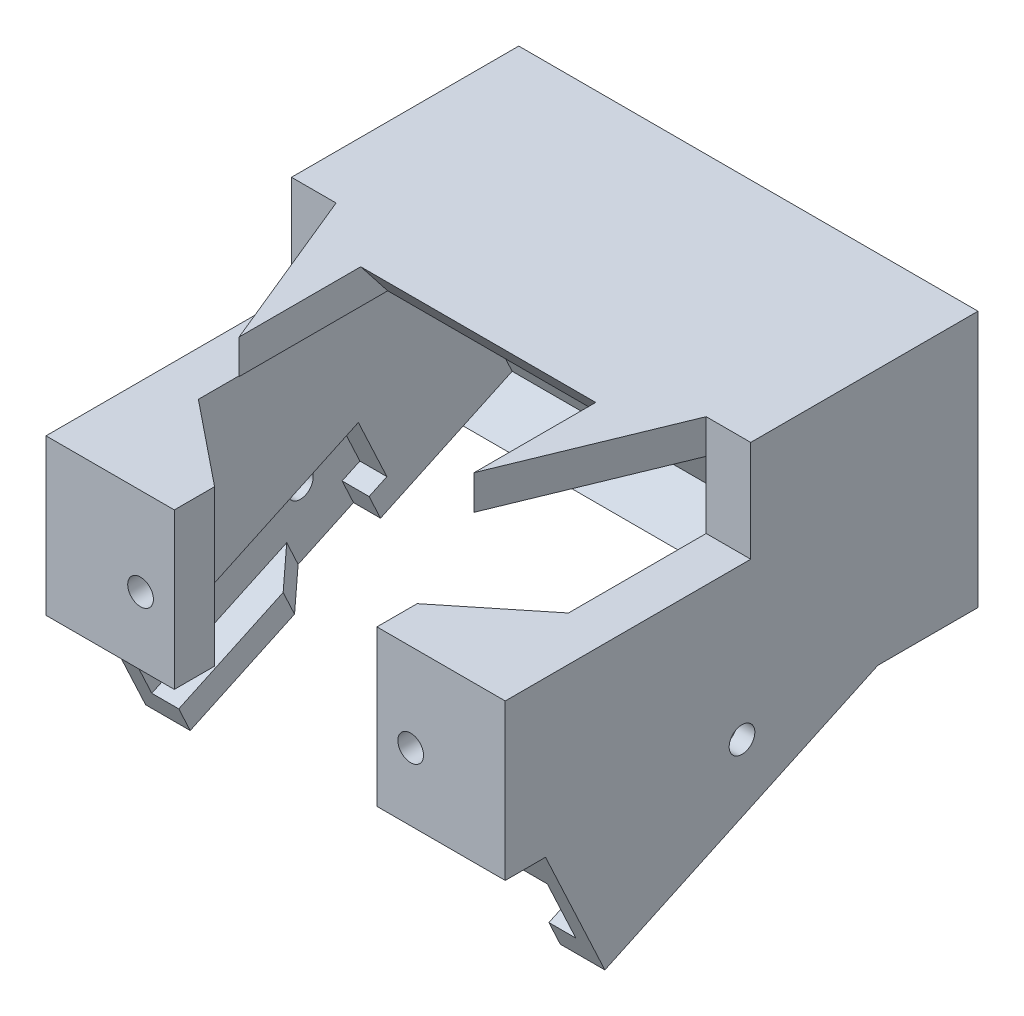
from build123d import *
from build123d.topology import SkipClean

# Parameters (mm, degrees)
CROQUIS1_W              = 34
CROQUIS1_H              = 19
SALIENTE_EXTRUIR1_DEPTH = 35
SALIENTE_EXTRUIR2_DEPTH = 34
CROQUIS5_W              = 27.4
CROQUIS5_H              = 22.3
CORTAR_EXTRUIR1_DEPTH   = 11
CROQUIS6_W              = 27.4
CROQUIS6_H              = 11
CORTAR_EXTRUIR2_DEPTH   = 4
CROQUIS7_W              = 10
CROQUIS7_H              = 4
CORTAR_EXTRUIR3_DEPTH   = 4
CROQUIS8_W              = 2
CROQUIS8_H              = 5
CORTAR_EXTRUIR4_DEPTH   = 17
CORTAR_EXTRUIR7_DEPTH   = 27.4
CORTAR_EXTRUIR8_DEPTH   = 21
CROQUIS17_W             = 34
CROQUIS17_H             = 18.17495386
CORTAR_EXTRUIR10_DEPTH  = 7.490137
SALIENTE_EXTRUIR3_DEPTH = 9.5
SALIENTE_EXTRUIR4_START = -11.509858
SALIENTE_EXTRUIR4_DEPTH = 11.509858
SALIENTE_EXTRUIR5_DEPTH = 9.5
SALIENTE_EXTRUIR6_START = -11.509858
SALIENTE_EXTRUIR6_DEPTH = 11.509858
CROQUIS23_R             = 0.95
CORTAR_EXTRUIR11_DEPTH  = 6
CORTAR_EXTRUIR12_START  = -2.5
CROQUIS24_R             = 0.95
CORTAR_EXTRUIR12_DEPTH  = 2.5
CORTAR_EXTRUIR13_START  = -34
CROQUIS28_R             = 0.95
CORTAR_EXTRUIR13_DEPTH  = 34
CORTAR_EXTRUIR14_DEPTH  = 2.82505
SALIENTE_EXTRUIR7_DEPTH = 2.543058
CORTAR_EXTRUIR15_DEPTH  = 17.4
CORTAR_EXTRUIR16_DEPTH  = 31.4
CORTAR_EXTRUIR17_DEPTH  = 2


with BuildPart() as part:
    # Croquis1 → Saliente-Extruir1 (new body)
    with BuildSketch(Plane.XY):
        with Locations((-40.669902913, 15.985436893)):
            Rectangle(CROQUIS1_W, CROQUIS1_H)
    extrude(amount=SALIENTE_EXTRUIR1_DEPTH)

    # Croquis2 → Saliente-Extruir2 (add)
    with BuildSketch(Plane(origin=(-23.669902913, 0, 0), x_dir=(0, 0, -1), z_dir=(1, 0, 0))):
        Polygon((-27.624175327, -2.938950344), (-7.413511676, 6.485436893), (-32.018839269, 6.485436893), align=None)
    extrude(amount=-SALIENTE_EXTRUIR2_DEPTH)

    # Croquis5 → Cortar-Extruir1 (cut)
    with BuildSketch(Plane(origin=(0, 8.166637397, 3.80816556), x_dir=(1, 0, 0), z_dir=(0, -0.9063077870366493, -0.422618261740701))):
        with Locations((-40.669902913, 15.128059295)):
            Rectangle(CROQUIS5_W, CROQUIS5_H)
    extrude(amount=-CORTAR_EXTRUIR1_DEPTH, mode=Mode.SUBTRACT)

    # Croquis6 → Cortar-Extruir2 (cut)
    with BuildSketch(Plane(origin=(0, -1.681200504, 3.605346116), x_dir=(1, 0, 0), z_dir=(0, -0.42261826174070105, 0.9063077870366493))):
        with Locations((-40.669902913, 14.510887376)):
            Rectangle(CROQUIS6_W, CROQUIS6_H)
    extrude(amount=-CORTAR_EXTRUIR2_DEPTH, mode=Mode.SUBTRACT)

    # Croquis7 → Cortar-Extruir3 (cut)
    with BuildSketch(Plane(origin=(0, 8.166637397, 3.80816556), x_dir=(1, 0, 0), z_dir=(0, 0.9063077870366492, 0.42261826174070116))):
        with Locations((-31.969902913, -1.978059295)):
            Rectangle(CROQUIS7_W, CROQUIS7_H)
    extrude(amount=-CORTAR_EXTRUIR3_DEPTH, mode=Mode.SUBTRACT)

    # Croquis8 → Cortar-Extruir4 (cut)
    with BuildSketch(Plane(origin=(0, -11.105587741, 23.816009767), x_dir=(1, 0, 0), z_dir=(0, -0.42261826174070116, 0.9063077870366492))):
        with Locations((-25.969902913, 13.510887376)):
            Rectangle(CROQUIS8_W, CROQUIS8_H)
        with Locations((-55.369902913, 13.510887376)):
            Rectangle(CROQUIS8_W, CROQUIS8_H)
    extrude(amount=-CORTAR_EXTRUIR4_DEPTH, mode=Mode.SUBTRACT)

    # Croquis14 → Cortar-Extruir7 (cut)
    with BuildSketch(Plane(origin=(-54.369902913, 0, 0), x_dir=(0, 0, -1), z_dir=(1, 0, 0))):
        Polygon((-32.843392043, 18.901603149), (-17.164267328, 26.212899077), (-16.741649066, 25.30659129), (-8.437081407, 18.145295598), (-32.272976206, 7.030435314), (-32.420773782, 17.995295362), align=None)
    extrude(amount=CORTAR_EXTRUIR7_DEPTH, mode=Mode.SUBTRACT)

    # Croquis15 → Cortar-Extruir8 (cut)
    with BuildSketch(Plane.XY.offset(35)):
        Polygon((-40.669902913, 6.485436893), (-48.169902913, 6.485436893), (-48.169902913, 25.485436893), (-33.169902913, 25.485436893), (-33.169902913, 6.485436893), align=None)
    extrude(amount=-CORTAR_EXTRUIR8_DEPTH, mode=Mode.SUBTRACT)

    # Croquis17 → Cortar-Extruir10 (cut)
    with BuildSketch(Plane(origin=(0, 25.485436893, 0), x_dir=(1, 0, 0), z_dir=(0, 1, 0))):
        with Locations((-40.669902913, -25.91252307)):
            Rectangle(CROQUIS17_W, CROQUIS17_H)
    extrude(amount=-CORTAR_EXTRUIR10_DEPTH, mode=Mode.SUBTRACT)

    # Croquis19 → Saliente-Extruir3 (add)
    with BuildSketch(Plane(origin=(-48.169902913, 0, 0), x_dir=(0, 0, -1), z_dir=(1, 0, 0))):
        Polygon((-32.018839269, 6.485436893), (-32.018839269, 17.995295362), (-32.420773782, 17.995295362), (-32.272976206, 7.030435314), align=None)
    extrude(amount=-SALIENTE_EXTRUIR3_DEPTH)

    # Croquis20 → Saliente-Extruir4 (add)
    with SkipClean():  # the faces are left unmerged after this step: merging them gives an invalid solid
        with BuildSketch(Plane.XZ.offset(-6.485436893).offset(SALIENTE_EXTRUIR4_START)):
            Polygon((-48.169902913, 32.018839269), (-54.369902913, 27.018839269), (-54.369902913, 32.018839269), align=None)
        extrude(amount=SALIENTE_EXTRUIR4_DEPTH)

    # Croquis21 → Saliente-Extruir5 (add)
    with SkipClean():  # the faces are left unmerged after this step: merging them gives an invalid solid
        with BuildSketch(Plane.ZY.offset(33.169902913)):
            Polygon((32.018839269, 6.485436893), (32.018839269, 17.995295362), (32.420773782, 17.995295362), (32.272976206, 7.030435314), align=None)
        extrude(amount=-SALIENTE_EXTRUIR5_DEPTH)

    # Croquis22 → Saliente-Extruir6 (add)
    with SkipClean():  # the faces are left unmerged after this step: merging them gives an invalid solid
        with BuildSketch(Plane.XZ.offset(-6.485436893).offset(SALIENTE_EXTRUIR6_START)):
            Polygon((-26.969902913, 32.018839269), (-26.969902913, 27.018839269), (-33.169902913, 32.018839269), align=None)
        extrude(amount=SALIENTE_EXTRUIR6_DEPTH)

    # Croquis23 → Cortar-Extruir11 (cut)
    with SkipClean():  # the faces are left unmerged after this step: merging them gives an invalid solid
        with BuildSketch(Plane(origin=(0, 0, 0), x_dir=(-1, 0, 0), z_dir=(0, 0, -1))):
            with Locations((30.669902913, 19.485436893)):
                Circle(CROQUIS23_R)
            with Locations((50.669902913, 19.485436893)):
                Circle(CROQUIS23_R)
            with Locations((30.669902913, 11.485436893)):
                Circle(CROQUIS23_R)
            with Locations((50.669902913, 11.485436893)):
                Circle(CROQUIS23_R)
        extrude(amount=-CORTAR_EXTRUIR11_DEPTH, mode=Mode.SUBTRACT)

    # Croquis24 → Cortar-Extruir12 (cut)
    with SkipClean():  # the faces are left unmerged after this step: merging them gives an invalid solid
        with BuildSketch(Plane.XY.offset(35).offset(CORTAR_EXTRUIR12_START)):
            with Locations(Location((-50.669902913, 11.485436893, 0), (0, 0, 180))):
                Circle(CROQUIS24_R)
            with Locations(Location((-30.669902913, 11.485436893, 0), (0, 0, 180))):
                Circle(CROQUIS24_R)
        extrude(amount=CORTAR_EXTRUIR12_DEPTH, mode=Mode.SUBTRACT)

    # Croquis28 → Cortar-Extruir13 (cut)
    with SkipClean():  # the faces are left unmerged after this step: merging them gives an invalid solid
        with BuildSketch(Plane(origin=(-23.669902913, 0, 0), x_dir=(0, 0, -1), z_dir=(1, 0, 0)).offset(CORTAR_EXTRUIR13_START)):
            with Locations((-17.472063937, 6.760257579)):
                Circle(CROQUIS28_R)
        extrude(amount=CORTAR_EXTRUIR13_DEPTH, mode=Mode.SUBTRACT)

    # Croquis29 → Cortar-Extruir14 (cut)
    with SkipClean():  # the faces are left unmerged after this step: merging them gives an invalid solid
        with BuildSketch(Plane.XY.offset(14)):
            Polygon((-40.669902913, 25.485436893), (-54.369902913, 25.485436893), (-54.369902913, 22.942379154), (-26.969902913, 22.942379154), (-26.969902913, 25.485436893), align=None)
        extrude(amount=CORTAR_EXTRUIR14_DEPTH, mode=Mode.SUBTRACT)

    # Croquis30 → Saliente-Extruir7 (add)
    with SkipClean():  # the faces are left unmerged after this step: merging them gives an invalid solid
        with BuildSketch(Plane(origin=(0, 25.485436893, 0), x_dir=(1, 0, 0), z_dir=(0, 1, 0))):
            Polygon((-54.369902913, -14), (-49.369902913, -14), (-31.969902913, -14), (-26.969902913, -14), (-26.969902913, -16.82504614), (-31.969902913, -29), (-31.969902913, -20), (-49.369902913, -20), (-49.369902913, -29), (-54.369902913, -16.82504614), align=None)
        extrude(amount=-SALIENTE_EXTRUIR7_DEPTH)

    # Croquis31 → Cortar-Extruir15 (cut)
    with SkipClean():  # the faces are left unmerged after this step: merging them gives an invalid solid
        with BuildSketch(Plane(origin=(-49.369902913, 0, 0), x_dir=(0, 0, -1), z_dir=(1, 0, 0))):
            Polygon((-20, 25.485436893), (-20, 22.942379154), (-18, 22.942379154), align=None)
        extrude(amount=CORTAR_EXTRUIR15_DEPTH, mode=Mode.SUBTRACT)

    # Croquis33 → Cortar-Extruir16 (cut)
    with SkipClean():  # the faces are left unmerged after this step: merging them gives an invalid solid
        with BuildSketch(Plane(origin=(-56.369902913, 0, 0), x_dir=(0, 0, -1), z_dir=(1, 0, 0))):
            with BuildLine():
                Line((-19.516769388, 5.821279614), (-17.472063937, 1.368757258))
                Line((-17.472063937, 1.368757258), (-13.360675292, 3.256805897))
                Line((-13.360675292, 3.256805897), (-15.427358486, 7.699235544))
                ThreePointArc((-15.427358486, 7.699235544), (-18.411041902, 8.80496303), (-19.516769388, 5.821279614))
            make_face()
        extrude(amount=CORTAR_EXTRUIR16_DEPTH, mode=Mode.SUBTRACT)

    # Croquis34 → Cortar-Extruir17 (cut)
    with SkipClean():  # the faces are left unmerged after this step: merging them gives an invalid solid
        with BuildSketch(Plane(origin=(0, 8.166637397, 3.80816556), x_dir=(1, 0, 0), z_dir=(0, -0.9063077870366493, -0.422618261740701))):
            Polygon((-26.969902913, 17.754351678), (-26.969902913, 14.803415118), (-24.969902913, 14.803415118), (-24.969902913, 15.254351678), align=None)
            Polygon((-54.369902913, 17.754351678), (-54.369902913, 14.803415118), (-56.369902913, 14.803415118), (-56.369902913, 15.254351678), align=None)
        extrude(amount=-CORTAR_EXTRUIR17_DEPTH, mode=Mode.SUBTRACT)


solid = part.part
